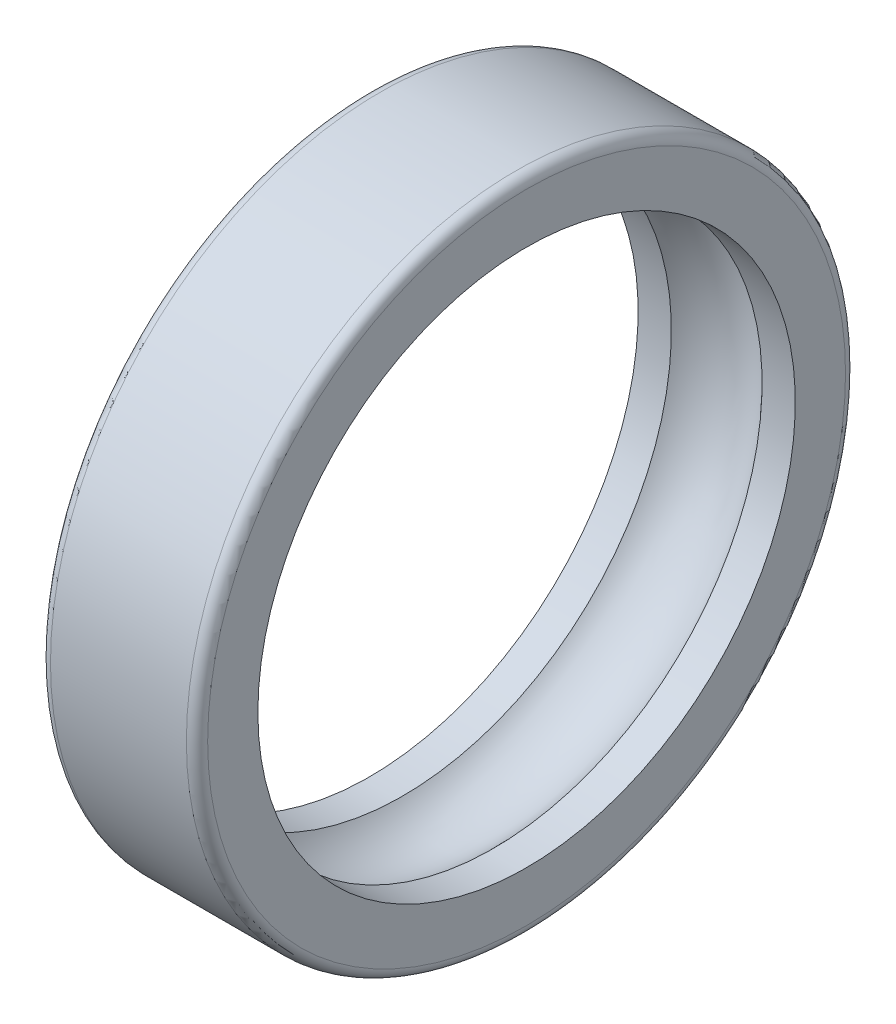
from build123d import *

# Parameters (mm, degrees)
RADYUS1_R = 2.1


with BuildPart() as part:
    # Çizim1 → Döndür1 (revolve)
    with BuildSketch(Plane.XY, mode=Mode.PRIVATE) as d_nd_r1_sk:
        with BuildLine():
            Line((-15.5, 53), (-8.94427191, 53))
            ThreePointArc((-8.94427191, 53), (0, 57), (8.94427191, 53))
            Line((8.94427191, 53), (15.5, 53))
            Line((15.5, 53), (15.5, 65))
            Line((15.5, 65), (-15.5, 65))
            Line((-15.5, 65), (-15.5, 53))
        make_face()
    revolve(d_nd_r1_sk.sketch.rotate(Axis((-12.334507042, 0, 0), (1, 0, 0)), 90), axis=Axis((-12.334507042, 0, 0), (1, 0, 0)))

    # Radyus1
    radyus1_edges = [part.edges().sort_by_distance(p)[0] for p in [
        (15.5, 0, -65),
        (-15.5, 0, -65),
    ]]
    fillet(radyus1_edges, radius=RADYUS1_R)


solid = part.part
